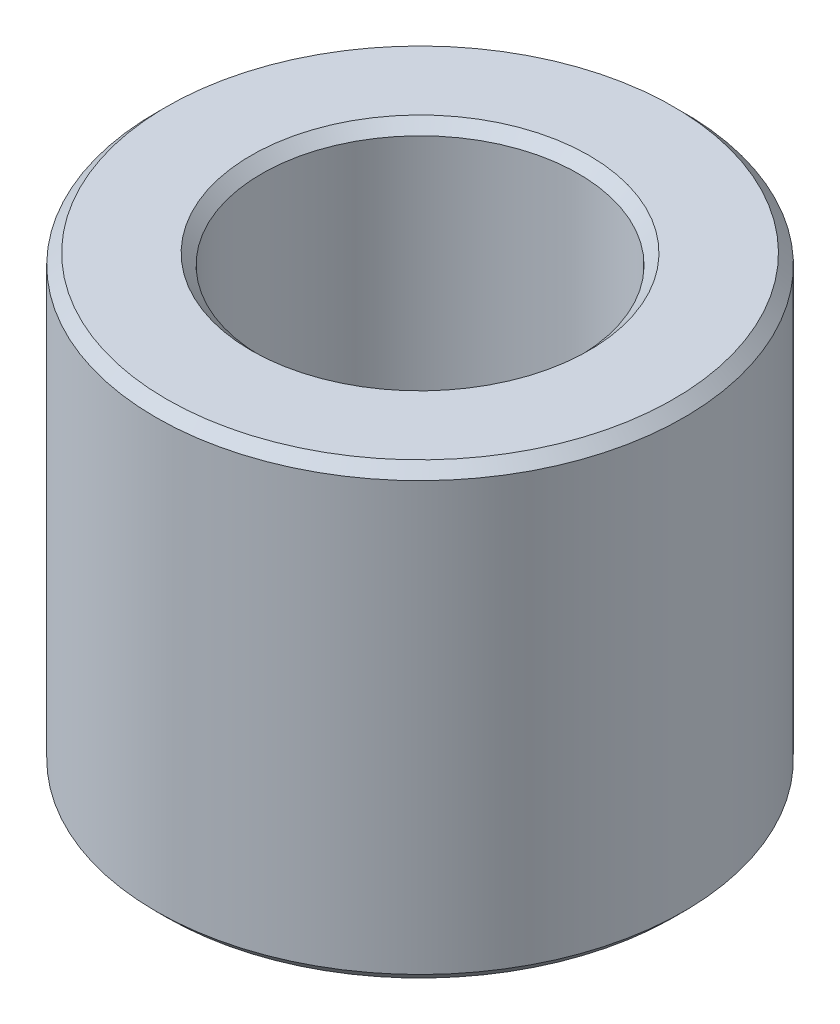
from build123d import *

# Parameters (mm, degrees)
SKETCH1_R           = 5
SKETCH1_R_2         = 3
BOSS_EXTRUDE1_DEPTH = 8.5
CHAMFER1_SIZE       = 0.2


with BuildPart() as part:
    # Sketch1 → Boss-Extrude1 (new body)
    with BuildSketch(Plane(origin=(0, 0, 0), x_dir=(1, 0, 0), z_dir=(0, 1, 0))):
        with Locations(Location((0, 0, 0), (0, 0, 270))):
            Circle(SKETCH1_R)
        with Locations(Location((0, 0, 0), (0, 0, 270))):
            Circle(SKETCH1_R_2, mode=Mode.SUBTRACT)
    extrude(amount=BOSS_EXTRUDE1_DEPTH)

    # Chamfer1
    chamfer1_edges = [part.edges().sort_by_distance(p)[0] for p in [
        (0, 0, -5),
        (0, 8.5, -5),
        (0, 0, -3),
        (0, 8.5, -3),
    ]]
    chamfer(chamfer1_edges, length=CHAMFER1_SIZE)


solid = part.part
